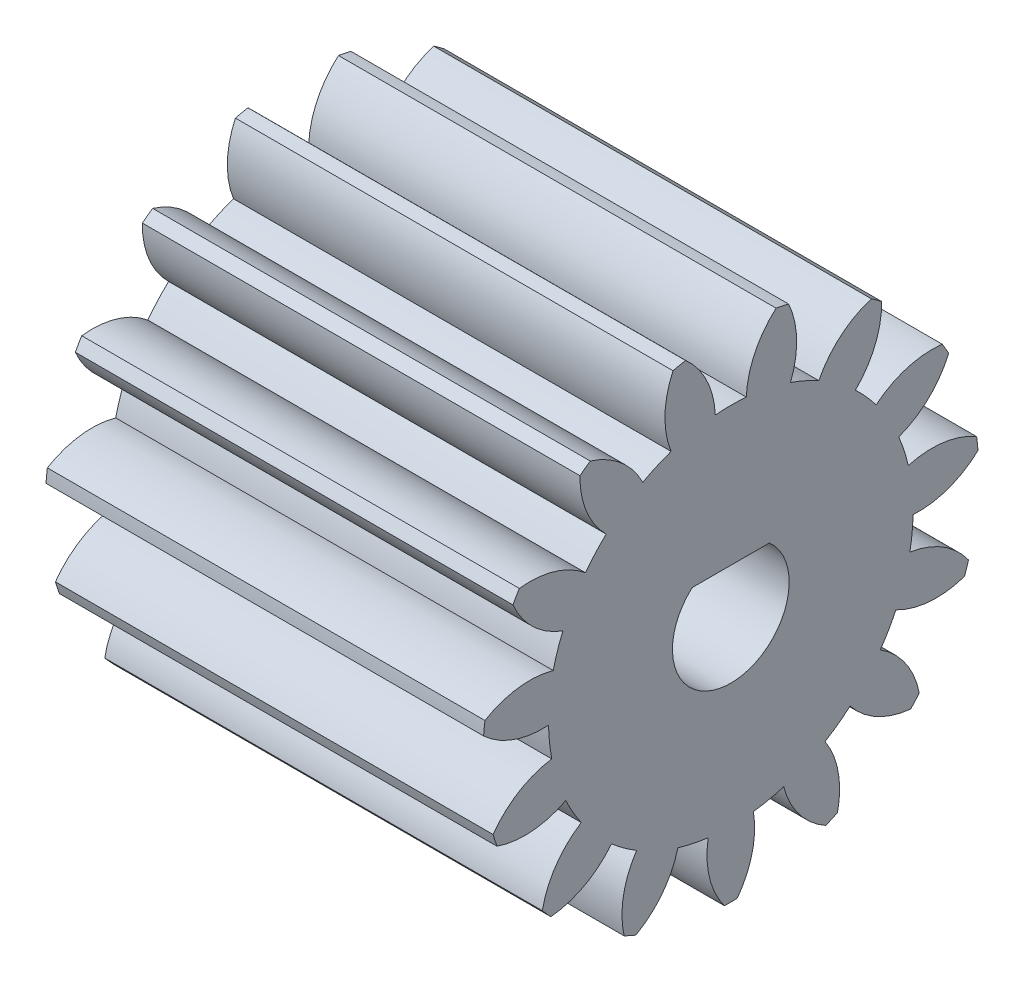
from build123d import *

# Parameters (mm, degrees)
BASPROSKE_W         = 15
BASPROSKE_H         = 8.5
TOOTHCUT_DEPTH      = 20.222382787
TEETHCUTS_COUNT     = 15
TEETHCUTS_ANGLE     = 336
BORSKE_R            = 2
BORE_DEPTH          = 50.0000508
BOSS_EXTRUDE1_DEPTH = 15


with BuildPart() as part:
    # BasProSke → Base-Revolve (revolve)
    with BuildSketch(Plane(origin=(0, 0, 0), x_dir=(1, 0, 0), z_dir=(0, 1, 0)), mode=Mode.PRIVATE) as base_revolve_sk:
        with Locations((7.5, 4.25)):
            Rectangle(BASPROSKE_W, BASPROSKE_H)
    revolve(base_revolve_sk.sketch.rotate(Axis((-10, 0, 0), (1, 0, 0)), 180), axis=Axis((-10, 0, 0), (1, 0, 0)))

    # TooCutSke → ToothCut (cut, through all)
    with BuildSketch(Plane(origin=(0, 0, 0), x_dir=(0, 0, -1), z_dir=(1, 0, 0))):
        with BuildLine():
            ThreePointArc((0.531576138, 6.226349477), (0, 6.249), (-0.531576138, 6.226349477))
            ThreePointArc((-0.531576138, 6.226349477), (-0.830301624, 7.411024729), (-1.576608494, 8.378350125))
            ThreePointArc((-1.576608494, 8.378350125), (0, 8.5254), (1.576608494, 8.378350125))
            ThreePointArc((1.576608494, 8.378350125), (0.830301624, 7.411024729), (0.531576138, 6.226349477))
        make_face()
    toothcut = extrude(amount=TOOTHCUT_DEPTH, mode=Mode.SUBTRACT)

    # TeethCuts: ToothCut ×15 about axis
    teethcuts_axis = Axis((-10, 0, 0), (1, 0, 0))
    for i in range(1, TEETHCUTS_COUNT):
        add(toothcut.rotate(teethcuts_axis, i * TEETHCUTS_ANGLE / (TEETHCUTS_COUNT - 1)), mode=Mode.SUBTRACT)

    # BorSke → Bore (cut, symmetric)
    with BuildSketch(Plane(origin=(0, 0, 0), x_dir=(0, 0, -1), z_dir=(1, 0, 0))):
        with Locations(Location((0, 0, 0), (0, 0, 180))):
            Circle(BORSKE_R)
    extrude(amount=BORE_DEPTH, both=True, mode=Mode.SUBTRACT)

    # Sketch1 → Boss-Extrude1 (add)
    with BuildSketch(Plane(origin=(15, 0, 0), x_dir=(0, 0, -1), z_dir=(1, 0, 0))):
        with BuildLine():
            ThreePointArc((-1.322875656, 1.5), (0, 2), (1.322875656, 1.5))
            Line((1.322875656, 1.5), (-1.322875656, 1.5))
        make_face()
    extrude(amount=-BOSS_EXTRUDE1_DEPTH)


solid = part.part
